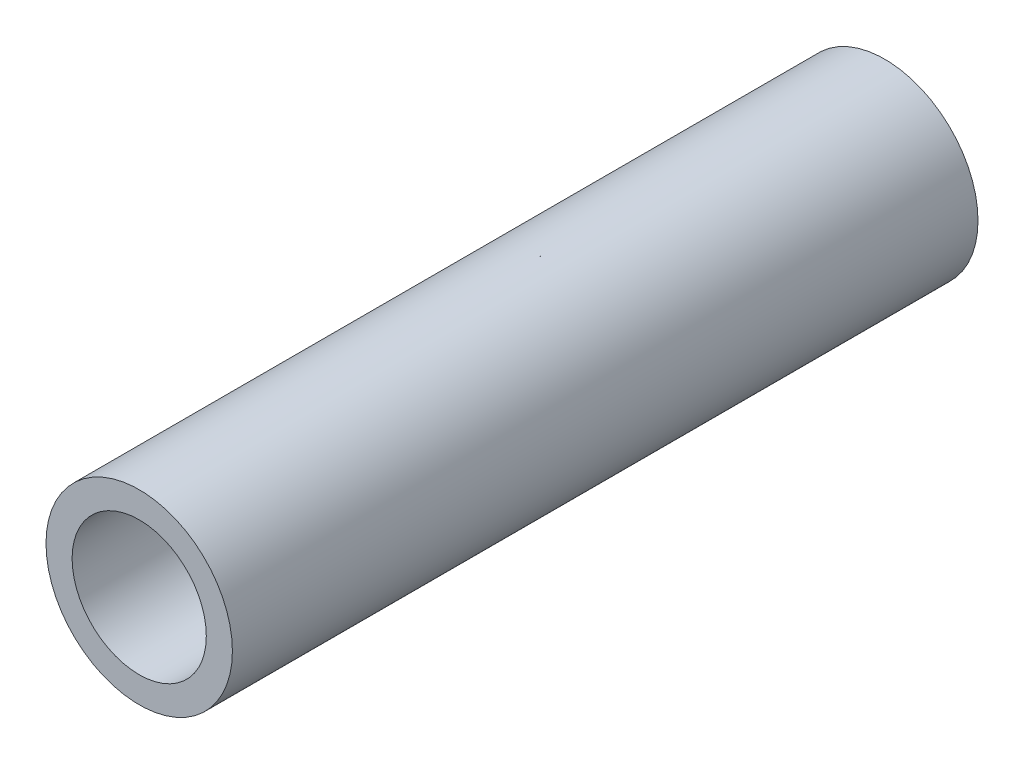
from build123d import *

# Parameters (mm, degrees)
CROQUIS1_R                 = 2.5
CROQUIS1_R_2               = 1.8
SALIENTE_EXTRUIR1_DEPTH    = 20
CROQUIS3_R                 = 1.8
SALIENTE_EXTRUIR2_DEPTH    = 3.15
CORTAR_EXTRUIR1_DEPTH      = 21.310096012
CORTAR_EXTRUIR1_DEPTH_BACK = 21.310096012
CROQUIS4_R                 = 1.12


with BuildPart() as part:
    # Croquis1 → Saliente-Extruir1 (new body)
    with BuildSketch(Plane.XY):
        Circle(CROQUIS1_R)
        Circle(CROQUIS1_R_2, mode=Mode.SUBTRACT)
    extrude(amount=SALIENTE_EXTRUIR1_DEPTH)

    # Croquis3 → Saliente-Extruir2 (add)
    with BuildSketch(Plane(origin=(0, 0, 0), x_dir=(-1, 0, 0), z_dir=(0, 0, -1))):
        Circle(CROQUIS3_R)
    extrude(amount=-SALIENTE_EXTRUIR2_DEPTH)

    # Croquis4 → Cortar-Extruir1 (cut, two sides: drawn at the far end of the back side and taken through both)
    with BuildSketch(Plane(origin=(0, 0, 0), x_dir=(-1, 0, 0), z_dir=(0, 0, -1)).offset(-CORTAR_EXTRUIR1_DEPTH_BACK)):
        Circle(CROQUIS4_R)
    extrude(amount=CORTAR_EXTRUIR1_DEPTH + CORTAR_EXTRUIR1_DEPTH_BACK, mode=Mode.SUBTRACT)


solid = part.part
